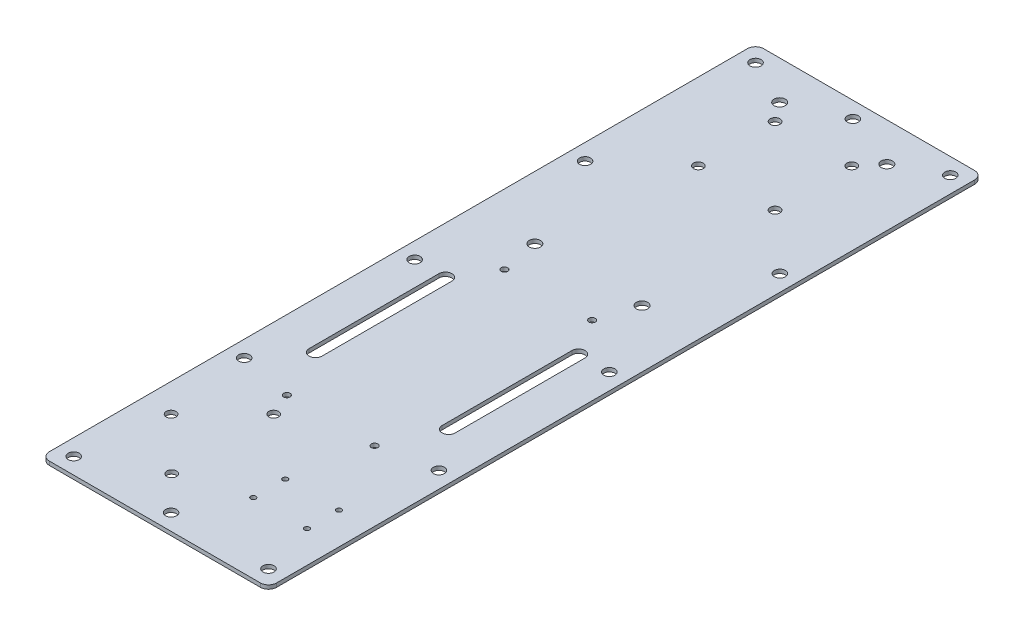
from build123d import *

# Parameters (mm, degrees)
PLATE_THICKNESS_DEPTH         = 1.5
SKETCH3_R                     = 2.159
MOUNTING_HOLES_DEPTH          = 147.608807716
SKETCH4_R                     = 2.2225
JETSON_HOLES_W_MOUNT_DEPTH    = 147.608807716
SKETCH5_R                     = 1.905
PDB_HOLES_DEPTH               = 147.608807716
SKETCH6_R                     = 1.905
LIDAR_HOLES_DEPTH             = 147.608807716
SKETCH7_R                     = 1.27
PIXHAWK_HOLES_DEPTH           = 147.608807716
BATTERY_HOLES_DEPTH           = 147.608807716
SKETCH_9_R                    = 1
VENTRAL_BOARDCAM_HOLLES_DEPTH = 147.608807716


with BuildPart() as part:
    # Sketch2 → Plate Thickness (new body)
    with BuildSketch(Plane(origin=(0, 0, 0), x_dir=(1, 0, 0), z_dir=(0, 1, 0))):
        with BuildLine():
            Line((-41.275, 139.7), (41.275, 139.7))
            ThreePointArc((41.275, 139.7), (43.52006403, 138.77006403), (44.45, 136.525))
            Line((44.45, 136.525), (44.45, -136.525))
            ThreePointArc((44.45, -136.525), (43.52006403, -138.77006403), (41.275, -139.7))
            Line((41.275, -139.7), (-41.275, -139.7))
            ThreePointArc((-41.275, -139.7), (-43.52006403, -138.77006403), (-44.45, -136.525))
            Line((-44.45, -136.525), (-44.45, 136.525))
            ThreePointArc((-44.45, 136.525), (-43.52006403, 138.77006403), (-41.275, 139.7))
        make_face()
    extrude(amount=PLATE_THICKNESS_DEPTH)

    # Sketch3 → Mounting holes (cut, through all)
    with BuildSketch(Plane(origin=(0, 1.5, 0), x_dir=(1, 0, 0), z_dir=(0, 1, 0))):
        with Locations(Location((-38.1, 133.35, 0), (0, 0, 270))):
            Circle(SKETCH3_R)
        with Locations(Location((-38.1, 66.675, 0), (0, 0, 270))):
            Circle(SKETCH3_R)
        with Locations(Location((-38.1, -66.675, 0), (0, 0, 90))):
            Circle(SKETCH3_R)
        with Locations(Location((-38.1, -133.35, 0), (0, 0, 90))):
            Circle(SKETCH3_R)
        with Locations(Location((38.1, -133.35, 0), (0, 0, 270))):
            Circle(SKETCH3_R)
        with Locations(Location((38.1, -66.675, 0), (0, 0, 270))):
            Circle(SKETCH3_R)
        with Locations(Location((38.1, 66.675, 0), (0, 0, 90))):
            Circle(SKETCH3_R)
        with Locations(Location((38.1, 133.35, 0), (0, 0, 90))):
            Circle(SKETCH3_R)
        with Locations(Location((0, 133.35, 0), (0, 0, 270))):
            Circle(SKETCH3_R)
        with Locations(Location((0, -133.35, 0), (0, 0, 90))):
            Circle(SKETCH3_R)
        with Locations(Location((-38.1, 0, 0), (0, 0, 270))):
            Circle(SKETCH3_R)
        with Locations(Location((38.1, 0, 0), (0, 0, 90))):
            Circle(SKETCH3_R)
    extrude(amount=-MOUNTING_HOLES_DEPTH, mode=Mode.SUBTRACT)

    # Sketch4 → Jetson Holes (w/ mount) (cut, through all)
    with BuildSketch(Plane(origin=(0, 1.5, 0), x_dir=(1, 0, 0), z_dir=(0, 1, 0))):
        with Locations(Location((-19.937372124, 124.652240808, 0), (0, 0, 270))):
            Circle(SKETCH4_R)
        with Locations(Location((-19.937372124, 28.894240808, 0), (0, 0, 270))):
            Circle(SKETCH4_R)
        with Locations(Location((21.972627876, 28.894240808, 0), (0, 0, 90))):
            Circle(SKETCH4_R)
        with Locations(Location((21.972627876, 124.652240808, 0), (0, 0, 90))):
            Circle(SKETCH4_R)
    extrude(amount=-JETSON_HOLES_W_MOUNT_DEPTH, mode=Mode.SUBTRACT)

    # Sketch5 → PDB holes (cut, through all)
    with BuildSketch(Plane(origin=(0, 1.5, 0), x_dir=(1, 0, 0), z_dir=(0, 1, 0))):
        with Locations(Location((-14.341868752, 117.235149692, 0), (0, 0, 270))):
            Circle(SKETCH5_R)
        with Locations(Location((15.655531248, 117.235149692, 0), (0, 0, 270))):
            Circle(SKETCH5_R)
        with Locations(Location((15.655531248, 87.237749692, 0), (0, 0, 270))):
            Circle(SKETCH5_R)
        with Locations(Location((-14.341868752, 87.237749692, 0), (0, 0, 270))):
            Circle(SKETCH5_R)
    extrude(amount=-PDB_HOLES_DEPTH, mode=Mode.SUBTRACT)

    # Sketch6 → Lidar Holes (cut, through all)
    with BuildSketch(Plane(origin=(0, 1.5, 0), x_dir=(1, 0, 0), z_dir=(0, 1, 0))):
        with Locations(Location((-13.045738102, -120.071910819, 0), (0, 0, 270))):
            Circle(SKETCH6_R)
        with Locations(Location((-13.279829556, -79.940593557, 0), (0, 0, 270))):
            Circle(SKETCH6_R)
        with Locations(Location((-33.345829556, -100.005910819, 0), (0, 0, 270))):
            Circle(SKETCH6_R)
    extrude(amount=-LIDAR_HOLES_DEPTH, mode=Mode.SUBTRACT)

    # Sketch7 → PixHawk Holes (cut, through all)
    with BuildSketch(Plane(origin=(0, 1.5, 0), x_dir=(1, 0, 0), z_dir=(0, 1, 0))):
        with Locations(Location((-17.145, 14.172396373, 0), (0, 0, 270))):
            Circle(SKETCH7_R)
        with Locations(Location((-17.145, -70.917603627, 0), (0, 0, 270))):
            Circle(SKETCH7_R)
        with Locations(Location((17.145, -70.917603627, 0), (0, 0, 270))):
            Circle(SKETCH7_R)
        with Locations(Location((17.145, 14.172396373, 0), (0, 0, 270))):
            Circle(SKETCH7_R)
    extrude(amount=-PIXHAWK_HOLES_DEPTH, mode=Mode.SUBTRACT)

    # Sketch8 → Battery Holes (cut, through all)
    with BuildSketch(Plane(origin=(0, 1.5, 0), x_dir=(1, 0, 0), z_dir=(0, 1, 0))):
        with BuildLine():
            Line((-23.495, -0.005964701), (-23.495, -50.805964701))
            ThreePointArc((-23.495, -50.805964701), (-26.035, -53.345964701), (-28.575, -50.805964701))
            Line((-28.575, -50.805964701), (-28.575, -0.005964701))
            ThreePointArc((-28.575, -0.005964701), (-26.035, 2.534035299), (-23.495, -0.005964701))
        make_face()
        with BuildLine():
            Line((23.495, -0.005964701), (23.495, -50.805964701))
            ThreePointArc((23.495, -50.805964701), (26.035, -53.345964701), (28.575, -50.805964701))
            Line((28.575, -50.805964701), (28.575, -0.005964701))
            ThreePointArc((28.575, -0.005964701), (26.035, 2.534035299), (23.495, -0.005964701))
        make_face()
    extrude(amount=-BATTERY_HOLES_DEPTH, mode=Mode.SUBTRACT)

    # Sketch 9 → Ventral Boardcam Holles (cut, through all)
    with BuildSketch(Plane.XZ):
        with Locations(Location((31.996971539, 112.188342609, 0), (0, 0, 270))):
            Circle(SKETCH_9_R)
        with Locations(Location((10.996971539, 112.188342609, 0), (0, 0, 270))):
            Circle(SKETCH_9_R)
        with Locations(Location((10.996971539, 99.688342609, 0), (0, 0, 270))):
            Circle(SKETCH_9_R)
        with Locations(Location((31.996971539, 99.688342609, 0), (0, 0, 270))):
            Circle(SKETCH_9_R)
    extrude(amount=-VENTRAL_BOARDCAM_HOLLES_DEPTH, mode=Mode.SUBTRACT)


solid = part.part
